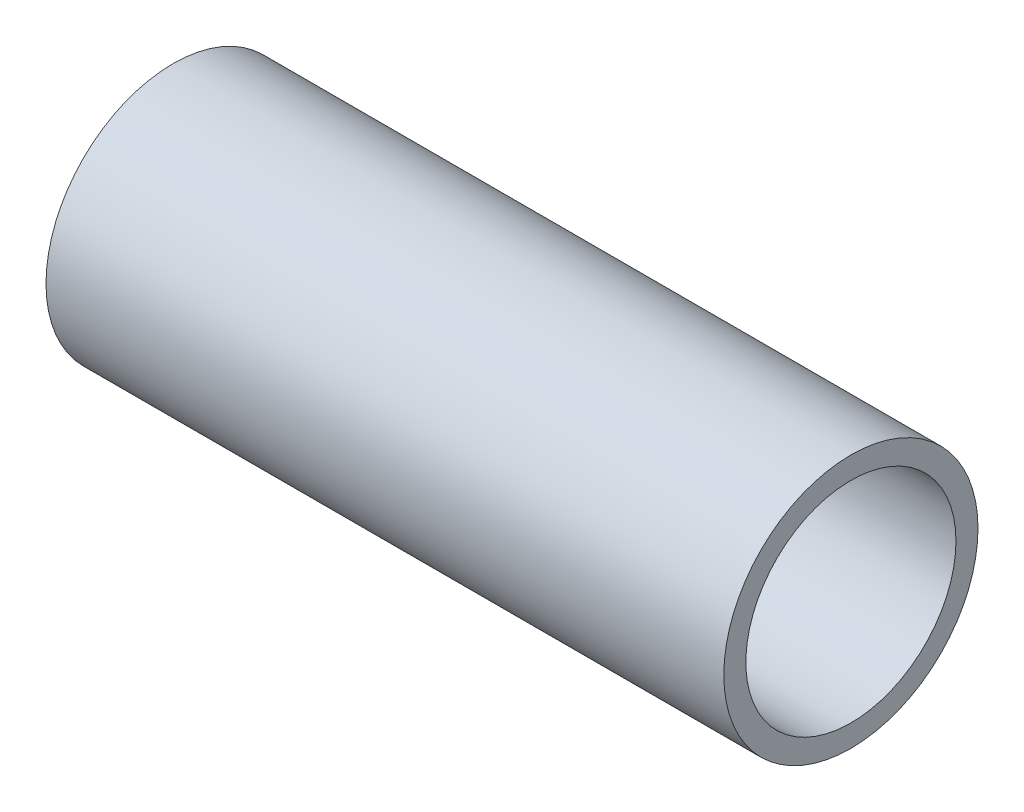
from build123d import *

# Parameters (mm, degrees)
SKETCH1_R           = 9.525
SKETCH1_R_2         = 7.874
BOSS_EXTRUDE1_DEPTH = 25.4


with BuildPart() as part:
    # Sketch1 → Boss-Extrude1 (new, symmetric)
    with BuildSketch(Plane(origin=(0, 0, 0), x_dir=(0, 0, -1), z_dir=(1, 0, 0))):
        Circle(SKETCH1_R)
        Circle(SKETCH1_R_2, mode=Mode.SUBTRACT)
    extrude(amount=BOSS_EXTRUDE1_DEPTH, both=True)


solid = part.part
